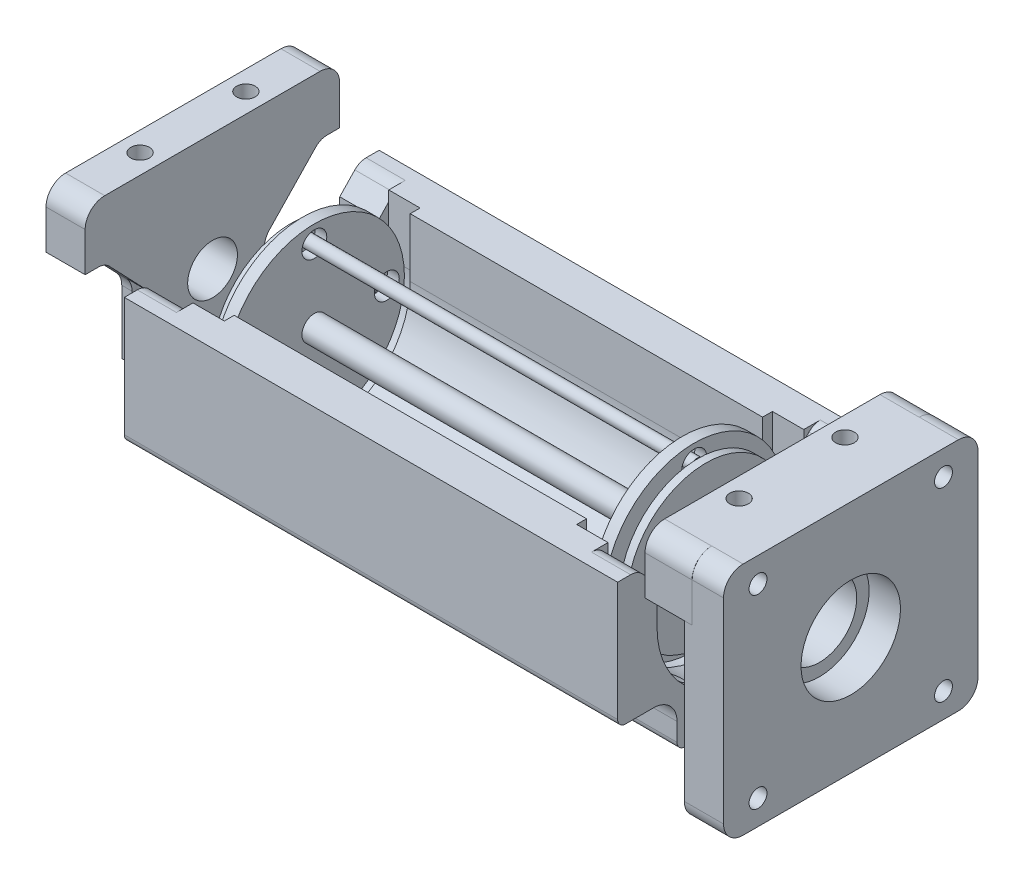
from build123d import *

# Parameters (mm, degrees)
SKETCH2_R                = 23
SKETCH2_R_2              = 3.175
BOSS_EXTRUDE2_DEPTH      = 3
BOSS_EXTRUDE3_DEPTH      = 90
SKETCH16_R               = 20.1
SKETCH16_R_2             = 3.175
BOSS_EXTRUDE7_DEPTH      = 2
SKETCH21_R               = 1.5875
COMPRESSION_RODS_DEPTH   = 50.8
COMPRESSION_RODS_2_DEPTH = 50.8
COMPRESSION_RODS_3_DEPTH = 50.8
COMPRESSION_RODS_4_DEPTH = 50.8
BOSS_EXTRUDE13_DEPTH     = 8
SKETCH27_R               = 2.286
BOSS_EXTRUDE17_DEPTH     = 5
BOSS_EXTRUDE22_DEPTH     = 5
BOSS_EXTRUDE27_DEPTH     = 10
SKETCH38_R               = 2.286
SKETCH38_R_2             = 12.7
BOSS_EXTRUDE25_DEPTH     = 10
SKETCH41_R               = 9.525
SKETCH41_R_2             = 2.286
BOSS_EXTRUDE29_DEPTH     = 12
SKETCH45_R               = 2.38125
CUT_EXTRUDE4_DEPTH       = 50
SKETCH47_R               = 2.38125
CUT_EXTRUDE5_DEPTH       = 50
BOSS_EXTRUDE30_DEPTH     = 10
SKETCH49_R               = 6.35
BOSS_EXTRUDE31_DEPTH     = 10
SKETCH50_R               = 2.38125
CUT_EXTRUDE6_DEPTH       = 50
SKETCH51_R               = 2.38125
CUT_EXTRUDE7_DEPTH       = 50
SKETCH28_R               = 3.175
BOSS_EXTRUDE34_DEPTH     = 63.5


with BuildPart() as part:
    # Sketch2 → Boss-Extrude2 (new body)
    with BuildSketch(Plane(origin=(-50, 0, 0), x_dir=(0, 0, -1), z_dir=(1, 0, 0))):
        Circle(SKETCH2_R)
        Circle(SKETCH2_R_2, mode=Mode.SUBTRACT)
        with Locations((0, 18.5125)):
            Circle(SKETCH2_R_2, mode=Mode.SUBTRACT)
        with Locations((-18.5125, 0)):
            Circle(SKETCH2_R_2, mode=Mode.SUBTRACT)
        with Locations((0, -18.5125)):
            Circle(SKETCH2_R_2, mode=Mode.SUBTRACT)
        with Locations((18.5125, 0)):
            Circle(SKETCH2_R_2, mode=Mode.SUBTRACT)
    extrude(amount=BOSS_EXTRUDE2_DEPTH)


with BuildPart() as body_2:
    # Sketch3 → Boss-Extrude3 (new body)
    with BuildSketch(Plane(origin=(45, 0, 0), x_dir=(0, 0, -1), z_dir=(1, 0, 0))):
        with BuildLine():
            Line((-22.48125, 0), (-22.48125, 15))
            Line((-22.48125, 15), (-32.54, 15))
            Line((-32.54, 15), (-32.54, -15.371))
            ThreePointArc((-32.54, -15.371), (-31.954213562, -16.785213562), (-30.54, -17.371))
            Line((-30.54, -17.371), (-23.371, -17.371))
            ThreePointArc((-23.371, -17.371), (-19.128359313, -19.128359313), (-17.371, -23.371))
            Line((-17.371, -23.371), (-17.371, -28))
            ThreePointArc((-17.371, -28), (-16.785213562, -29.414213562), (-15.371, -30))
            Line((-15.371, -30), (15.371, -30))
            ThreePointArc((15.371, -30), (16.785213562, -29.414213562), (17.371, -28))
            Line((17.371, -28), (17.371, -23.371))
            ThreePointArc((17.371, -23.371), (19.128359313, -19.128359313), (23.371, -17.371))
            Line((23.371, -17.371), (30, -17.371))
            Line((30, -17.371), (30.54, -17.371))
            ThreePointArc((30.54, -17.371), (31.954213562, -16.785213562), (32.54, -15.371))
            Line((32.54, -15.371), (32.54, 15))
            Line((32.54, 15), (22.48125, 15))
            Line((22.48125, 15), (22.48125, 0))
            ThreePointArc((22.48125, 0), (0, -22.48125), (-22.48125, 0))
        make_face()
    extrude(amount=-BOSS_EXTRUDE3_DEPTH)


with BuildPart() as body_3:
    # Sketch16 → Boss-Extrude7 (new body)
    with BuildSketch(Plane(origin=(-51, 0, 0), x_dir=(0, 0, -1), z_dir=(1, 0, 0))):
        Circle(SKETCH16_R)
        Circle(SKETCH16_R_2, mode=Mode.SUBTRACT)
    extrude(amount=-BOSS_EXTRUDE7_DEPTH)


with BuildPart() as body_4:
    # Sketch21 → Compression_Rods (new, symmetric)
    with BuildSketch(Plane(origin=(0, 0, 0), x_dir=(0, 0, -1), z_dir=(1, 0, 0))):
        with Locations((-18.5125, 0)):
            Circle(SKETCH21_R)
    extrude(amount=COMPRESSION_RODS_DEPTH, both=True)


with BuildPart() as body_5:
    # Sketch21 → Compression_Rods 2 (new, symmetric)
    with BuildSketch(Plane(origin=(0, 0, 0), x_dir=(0, 0, -1), z_dir=(1, 0, 0))):
        with Locations((0, 18.5125)):
            Circle(SKETCH21_R)
    extrude(amount=COMPRESSION_RODS_2_DEPTH, both=True)


with BuildPart() as body_6:
    # Sketch21 → Compression_Rods 3 (new, symmetric)
    with BuildSketch(Plane(origin=(0, 0, 0), x_dir=(0, 0, -1), z_dir=(1, 0, 0))):
        with Locations((18.5125, 0)):
            Circle(SKETCH21_R)
    extrude(amount=COMPRESSION_RODS_3_DEPTH, both=True)


with BuildPart() as body_7:
    # Sketch21 → Compression_Rods 4 (new, symmetric)
    with BuildSketch(Plane(origin=(0, 0, 0), x_dir=(0, 0, -1), z_dir=(1, 0, 0))):
        with Locations((0, -18.5125)):
            Circle(SKETCH21_R)
    extrude(amount=COMPRESSION_RODS_4_DEPTH, both=True)


with BuildPart() as body_8:
    # Mirror2: mirrored copy
    add(part.part.mirror(Plane(origin=(0, 0, 0), x_dir=(0, 0, 1), z_dir=(1, 0, 0))))


with BuildPart() as body_9:
    # Mirror2 2: mirrored copy
    add(body_3.part.mirror(Plane(origin=(0, 0, 0), x_dir=(0, 0, 1), z_dir=(1, 0, 0))))


with BuildPart() as body_10:
    # Sketch24 → Boss-Extrude13 (new body)
    with BuildSketch(Plane(origin=(45, 0, 0), x_dir=(0, 0, -1), z_dir=(1, 0, 0))):
        with BuildLine():
            Line((-25, 0), (-25, 15))
            Line((-25, 15), (-32.54, 15))
            Line((-32.54, 15), (-32.54, -15.371))
            ThreePointArc((-32.54, -15.371), (-31.954213562, -16.785213562), (-30.54, -17.371))
            Line((-30.54, -17.371), (-23.371, -17.371))
            ThreePointArc((-23.371, -17.371), (-19.128359313, -19.128359313), (-17.371, -23.371))
            Line((-17.371, -23.371), (-17.371, -28))
            ThreePointArc((-17.371, -28), (-16.785213562, -29.414213562), (-15.371, -30))
            Line((-15.371, -30), (15.371, -30))
            ThreePointArc((15.371, -30), (16.785213562, -29.414213562), (17.371, -28))
            Line((17.371, -28), (17.371, -23.371))
            ThreePointArc((17.371, -23.371), (19.128359313, -19.128359313), (23.371, -17.371))
            Line((23.371, -17.371), (30.54, -17.371))
            ThreePointArc((30.54, -17.371), (31.954213562, -16.785213562), (32.54, -15.371))
            Line((32.54, -15.371), (32.54, 15))
            Line((32.54, 15), (25, 15))
            Line((25, 15), (25, 0))
            ThreePointArc((25, 0), (0, -25), (-25, 0))
        make_face()
    extrude(amount=BOSS_EXTRUDE13_DEPTH)


with BuildPart() as body_11:
    # Sketch27 → Boss-Extrude17 (new body)
    with BuildSketch(Plane(origin=(70, 0, 0), x_dir=(0, 0, -1), z_dir=(1, 0, 0))):
        with BuildLine():
            Line((-5.175, 30), (-25, 30))
            ThreePointArc((-25, 30), (-28.535533906, 28.535533906), (-30, 25))
            Line((-30, 25), (-30, -25))
            ThreePointArc((-30, -25), (-28.535533906, -28.535533906), (-25, -30))
            Line((-25, -30), (25, -30))
            ThreePointArc((25, -30), (28.535533906, -28.535533906), (30, -25))
            Line((30, -25), (30, 25))
            ThreePointArc((30, 25), (28.535533906, 28.535533906), (25, 30))
            Line((25, 30), (5.175, 30))
            ThreePointArc((5.175, 30), (3.760786438, 29.414213562), (3.175, 28))
            Line((3.175, 28), (3.175, 20.403967139))
            ThreePointArc((3.175, 20.403967139), (3.596492331, 19.175832969), (4.683313539, 18.465347933))
            ThreePointArc((4.683313539, 18.465347933), (15.035285546, 11.697977968), (19.05, 0))
            ThreePointArc((19.05, 0), (0, -19.05), (-19.05, 0))
            ThreePointArc((-19.05, 0), (-15.035285546, 11.697977968), (-4.683313539, 18.465347933))
            ThreePointArc((-4.683313539, 18.465347933), (-3.596492331, 19.175832969), (-3.175, 20.403967139))
            Line((-3.175, 20.403967139), (-3.175, 28))
            ThreePointArc((-3.175, 28), (-3.760786438, 29.414213562), (-5.175, 30))
        make_face()
        with Locations((-23.6855, 23.6855)):
            Circle(SKETCH27_R, mode=Mode.SUBTRACT)
        with Locations((23.6855, 23.6855)):
            Circle(SKETCH27_R, mode=Mode.SUBTRACT)
        with Locations((-23.6855, -23.6855)):
            Circle(SKETCH27_R, mode=Mode.SUBTRACT)
        with Locations((23.6855, -23.6855)):
            Circle(SKETCH27_R, mode=Mode.SUBTRACT)
    extrude(amount=BOSS_EXTRUDE17_DEPTH)


with BuildPart() as body_12:
    # Mirror5: mirrored copy
    add(body_10.part.mirror(Plane(origin=(0, 0, 0), x_dir=(0, 0, 1), z_dir=(1, 0, 0))))


with BuildPart() as body_13:
    # Sketch34 → Boss-Extrude22 (new body)
    with BuildSketch(Plane(origin=(-75, 0, 0), x_dir=(0, 0, -1), z_dir=(1, 0, 0))):
        with BuildLine():
            Line((-25, 0), (-25, 18.548767392))
            ThreePointArc((-25, 18.548767392), (-28.416507095, 18.065687117), (-30, 15))
            Line((-30, 15), (-30, -15.371))
            ThreePointArc((-30, -15.371), (-29.414213562, -16.785213562), (-28, -17.371))
            Line((-28, -17.371), (-23.371, -17.371))
            ThreePointArc((-23.371, -17.371), (-19.128359313, -19.128359313), (-17.371, -23.371))
            Line((-17.371, -23.371), (-17.371, -28))
            ThreePointArc((-17.371, -28), (-16.785213562, -29.414213562), (-15.371, -30))
            Line((-15.371, -30), (15.371, -30))
            ThreePointArc((15.371, -30), (16.785213562, -29.414213562), (17.371, -28))
            Line((17.371, -28), (17.371, -23.371))
            ThreePointArc((17.371, -23.371), (19.128359313, -19.128359313), (23.371, -17.371))
            Line((23.371, -17.371), (28, -17.371))
            ThreePointArc((28, -17.371), (29.414213562, -16.785213562), (30, -15.371))
            Line((30, -15.371), (30, 15))
            ThreePointArc((30, 15), (28.416507095, 18.065687117), (25, 18.548767392))
            Line((25, 18.548767392), (25, 0))
            ThreePointArc((25, 0), (24.653626397, -4.147132198), (23.624103563, -8.179347826))
            ThreePointArc((23.624103563, -8.179347826), (22.894197766, -9.154216936), (21.734175278, -9.525))
            Line((21.734175278, -9.525), (-21.734175278, -9.525))
            ThreePointArc((-21.734175278, -9.525), (-22.894197766, -9.154216936), (-23.624103563, -8.179347826))
            ThreePointArc((-23.624103563, -8.179347826), (-24.653626397, -4.147132198), (-25, 0))
        make_face()
    extrude(amount=-BOSS_EXTRUDE22_DEPTH)


with BuildPart() as body_10_1:
    add(body_10.part)

    # Sketch37 → Boss-Extrude27 (add)
    with BuildSketch(Plane(origin=(53, 0, 0), x_dir=(0, 0, -1), z_dir=(1, 0, 0))):
        with BuildLine():
            Line((-22.48125, 0), (-22.48125, 9.737427432))
            Line((-22.48125, 9.737427432), (-26.329042153, 13.763630575))
            ThreePointArc((-26.329042153, 13.763630575), (-27.648319814, 14.677942516), (-29.220814282, 15))
            Line((-29.220814282, 15), (-32.54, 15))
            Line((-32.54, 15), (-32.54, -15.371))
            ThreePointArc((-32.54, -15.371), (-31.954213562, -16.785213562), (-30.54, -17.371))
            Line((-30.54, -17.371), (-23.371, -17.371))
            ThreePointArc((-23.371, -17.371), (-19.128359313, -19.128359313), (-17.371, -23.371))
            Line((-17.371, -23.371), (-17.371, -28))
            ThreePointArc((-17.371, -28), (-16.785213562, -29.414213562), (-15.371, -30))
            Line((-15.371, -30), (15.371, -30))
            ThreePointArc((15.371, -30), (16.785213562, -29.414213562), (17.371, -28))
            Line((17.371, -28), (17.371, -23.371))
            ThreePointArc((17.371, -23.371), (19.128359313, -19.128359313), (23.371, -17.371))
            Line((23.371, -17.371), (30, -17.371))
            Line((30, -17.371), (30.54, -17.371))
            ThreePointArc((30.54, -17.371), (31.954213562, -16.785213562), (32.54, -15.371))
            Line((32.54, -15.371), (32.54, 15))
            Line((32.54, 15), (29.220814282, 15))
            ThreePointArc((29.220814282, 15), (27.648319814, 14.677942516), (26.329042153, 13.763630575))
            Line((26.329042153, 13.763630575), (22.48125, 9.737427432))
            Line((22.48125, 9.737427432), (22.48125, 0))
            ThreePointArc((22.48125, 0), (0, -22.48125), (-22.48125, 0))
        make_face()
    extrude(amount=BOSS_EXTRUDE27_DEPTH)

    # Sketch47 → Cut-Extrude5 (cut)
    with BuildSketch(Plane.XZ.offset(30)):
        with Locations(Location((58, -13.51375, 0), (0, 0, 270))):
            Circle(SKETCH47_R)
    cut_extrude5 = extrude(amount=-CUT_EXTRUDE5_DEPTH, mode=Mode.SUBTRACT)

    # Mirror11: Cut-Extrude5 across plane
    add(cut_extrude5.mirror(Plane.XY), mode=Mode.SUBTRACT)


with BuildPart() as body_12_2:
    # Sketch38 → Boss-Extrude25 (new body)
    with BuildSketch(Plane(origin=(80, 0, 0), x_dir=(0, 0, -1), z_dir=(1, 0, 0))):
        with BuildLine():
            Line((-27.5, 30), (27.5, 30))
            ThreePointArc((27.5, 30), (31.035533906, 28.535533906), (32.5, 25))
            Line((32.5, 25), (32.5, -25))
            ThreePointArc((32.5, -25), (31.035533906, -28.535533906), (27.5, -30))
            Line((27.5, -30), (-27.5, -30))
            ThreePointArc((-27.5, -30), (-31.035533906, -28.535533906), (-32.5, -25))
            Line((-32.5, -25), (-32.5, 25))
            ThreePointArc((-32.5, 25), (-31.035533906, 28.535533906), (-27.5, 30))
        make_face()
        with Locations((-23.6855, 23.6855)):
            Circle(SKETCH38_R, mode=Mode.SUBTRACT)
        with Locations((23.6855, 23.6855)):
            Circle(SKETCH38_R, mode=Mode.SUBTRACT)
        with Locations((-23.6855, -23.6855)):
            Circle(SKETCH38_R, mode=Mode.SUBTRACT)
        with Locations((23.6855, -23.6855)):
            Circle(SKETCH38_R, mode=Mode.SUBTRACT)
        Circle(SKETCH38_R_2, mode=Mode.SUBTRACT)
    extrude(amount=BOSS_EXTRUDE25_DEPTH)


with BuildPart() as body_13_2:
    # Sketch41 → Boss-Extrude29 (new body)
    with BuildSketch(Plane(origin=(70, 0, 0), x_dir=(0, 0, -1), z_dir=(1, 0, 0))):
        with BuildLine():
            Line((-29.220814282, 15), (-32.54, 15))
            Line((-32.54, 15), (-32.54, 25))
            ThreePointArc((-32.54, 25), (-31.075533906, 28.535533906), (-27.54, 30))
            Line((-27.54, 30), (27.46, 30))
            ThreePointArc((27.46, 30), (30.995533906, 28.535533906), (32.46, 25))
            Line((32.46, 25), (32.46, 15))
            Line((32.46, 15), (29.220814282, 15))
            ThreePointArc((29.220814282, 15), (27.648319814, 14.677942516), (26.329042153, 13.763630575))
            Line((26.329042153, 13.763630575), (14.575802147, 1.465426835))
            ThreePointArc((14.575802147, 1.465426835), (13.549742814, -0.128140643), (13.190517308, -1.989111384))
            Line((13.190517308, -1.989111384), (13.190517308, -18.204857997))
            ThreePointArc((13.190517308, -18.204857997), (0, -22.48125), (-13.190517308, -18.204857997))
            Line((-13.190517308, -18.204857997), (-13.190517308, -1.989111384))
            ThreePointArc((-13.190517308, -1.989111384), (-13.549742814, -0.128140643), (-14.575802147, 1.465426835))
            Line((-14.575802147, 1.465426835), (-26.329042153, 13.763630575))
            ThreePointArc((-26.329042153, 13.763630575), (-27.648319814, 14.677942516), (-29.220814282, 15))
        make_face()
        Circle(SKETCH41_R, mode=Mode.SUBTRACT)
        with Locations((23.6855, 23.6855)):
            Circle(SKETCH41_R_2, mode=Mode.SUBTRACT)
        with Locations((-23.6855, 23.6855)):
            Circle(SKETCH41_R_2, mode=Mode.SUBTRACT)
    extrude(amount=BOSS_EXTRUDE29_DEPTH)

    # Sketch45 → Cut-Extrude4 (cut)
    with BuildSketch(Plane(origin=(0, 30, 0), x_dir=(1, 0, 0), z_dir=(0, 1, 0))):
        with Locations(Location((75, -13.51375, 0), (0, 0, 270))):
            Circle(SKETCH45_R)
    cut_extrude4 = extrude(amount=-CUT_EXTRUDE4_DEPTH, mode=Mode.SUBTRACT)

    # Mirror10: Cut-Extrude4 across plane
    add(cut_extrude4.mirror(Plane.XY), mode=Mode.SUBTRACT)

    # Combine4: union body 12 2
    add(body_12_2.part)


with BuildPart() as body_14:
    # Sketch48 → Boss-Extrude30 (new body)
    with BuildSketch(Plane(origin=(-53, 0, 0), x_dir=(0, 0, -1), z_dir=(1, 0, 0))):
        with BuildLine():
            Line((-22.48125, 0), (-22.48125, 9.737427432))
            Line((-22.48125, 9.737427432), (-26.329042153, 13.763630575))
            ThreePointArc((-26.329042153, 13.763630575), (-27.648319814, 14.677942516), (-29.220814282, 15))
            Line((-29.220814282, 15), (-32.54, 15))
            Line((-32.54, 15), (-32.54, -15.371))
            ThreePointArc((-32.54, -15.371), (-31.954213562, -16.785213562), (-30.54, -17.371))
            Line((-30.54, -17.371), (-23.371, -17.371))
            ThreePointArc((-23.371, -17.371), (-19.128359313, -19.128359313), (-17.371, -23.371))
            Line((-17.371, -23.371), (-17.371, -28))
            ThreePointArc((-17.371, -28), (-16.785213562, -29.414213562), (-15.371, -30))
            Line((-15.371, -30), (15.371, -30))
            ThreePointArc((15.371, -30), (16.785213562, -29.414213562), (17.371, -28))
            Line((17.371, -28), (17.371, -23.371))
            ThreePointArc((17.371, -23.371), (19.128359313, -19.128359313), (23.371, -17.371))
            Line((23.371, -17.371), (30, -17.371))
            Line((30, -17.371), (30.54, -17.371))
            ThreePointArc((30.54, -17.371), (31.954213562, -16.785213562), (32.54, -15.371))
            Line((32.54, -15.371), (32.54, 15))
            Line((32.54, 15), (29.220814282, 15))
            ThreePointArc((29.220814282, 15), (27.648319814, 14.677942516), (26.329042153, 13.763630575))
            Line((26.329042153, 13.763630575), (22.48125, 9.737427432))
            Line((22.48125, 9.737427432), (22.48125, 0))
            ThreePointArc((22.48125, 0), (0, -22.48125), (-22.48125, 0))
        make_face()
    extrude(amount=-BOSS_EXTRUDE30_DEPTH)

    # Sketch51 → Cut-Extrude7 (cut)
    with BuildSketch(Plane.XZ.offset(30)):
        with Locations(Location((-58, 13.49375, 0), (0, 0, 270))):
            Circle(SKETCH51_R)
    cut_extrude7 = extrude(amount=-CUT_EXTRUDE7_DEPTH, mode=Mode.SUBTRACT)

    # Mirror20: Cut-Extrude7 across plane
    add(cut_extrude7.mirror(Plane.XY), mode=Mode.SUBTRACT)


with BuildPart() as body_15:
    # Sketch49 → Boss-Extrude31 (new body)
    with BuildSketch(Plane(origin=(-73, 0, 0), x_dir=(0, 0, -1), z_dir=(1, 0, 0))):
        with BuildLine():
            Line((-29.220814282, 15), (-32.54, 15))
            Line((-32.54, 15), (-32.54, 25))
            ThreePointArc((-32.54, 25), (-31.075533906, 28.535533906), (-27.54, 30))
            Line((-27.54, 30), (27.46, 30))
            ThreePointArc((27.46, 30), (30.995533906, 28.535533906), (32.46, 25))
            Line((32.46, 25), (32.46, 15))
            Line((32.46, 15), (29.220814282, 15))
            ThreePointArc((29.220814282, 15), (27.648319814, 14.677942516), (26.329042153, 13.763630575))
            Line((26.329042153, 13.763630575), (14.575802147, 1.465426835))
            ThreePointArc((14.575802147, 1.465426835), (13.549742814, -0.128140643), (13.190517308, -1.989111384))
            Line((13.190517308, -1.989111384), (13.190517308, -18.204857997))
            ThreePointArc((13.190517308, -18.204857997), (0, -22.48125), (-13.190517308, -18.204857997))
            Line((-13.190517308, -18.204857997), (-13.190517308, -1.989111384))
            ThreePointArc((-13.190517308, -1.989111384), (-13.549742814, -0.128140643), (-14.575802147, 1.465426835))
            Line((-14.575802147, 1.465426835), (-26.329042153, 13.763630575))
            ThreePointArc((-26.329042153, 13.763630575), (-27.648319814, 14.677942516), (-29.220814282, 15))
        make_face()
        Circle(SKETCH49_R, mode=Mode.SUBTRACT)
    extrude(amount=-BOSS_EXTRUDE31_DEPTH)

    # Sketch50 → Cut-Extrude6 (cut)
    with BuildSketch(Plane(origin=(0, 30, 0), x_dir=(1, 0, 0), z_dir=(0, 1, 0))):
        with Locations(Location((-78, -13.51375, 0), (0, 0, 270))):
            Circle(SKETCH50_R)
    cut_extrude6 = extrude(amount=-CUT_EXTRUDE6_DEPTH, mode=Mode.SUBTRACT)

    # Mirror19: Cut-Extrude6 across plane
    add(cut_extrude6.mirror(Plane.XY), mode=Mode.SUBTRACT)


with BuildPart() as part_1:
    add(part.part)

    add(body_3.part)  # Boss-Extrude34 merges body 3

    add(body_8.part)  # Boss-Extrude34 merges body 8

    add(body_9.part)  # Boss-Extrude34 merges body 9

    add(body_2.part)  # Boss-Extrude34 merges body 2

    add(body_12.part)  # Boss-Extrude34 merges body 12

    add(body_10_1.part)  # Boss-Extrude34 merges body 10

    add(body_14.part)  # Boss-Extrude34 merges body 14
    # Sketch28 → Boss-Extrude34 (add, symmetric)
    with BuildSketch(Plane(origin=(0, 0, 0), x_dir=(0, 0, -1), z_dir=(1, 0, 0))):
        Circle(SKETCH28_R)
    extrude(amount=BOSS_EXTRUDE34_DEPTH, both=True)


solid = Compound([body_4.part, body_5.part, body_6.part, body_7.part, body_13_2.part, body_15.part, part_1.part])
